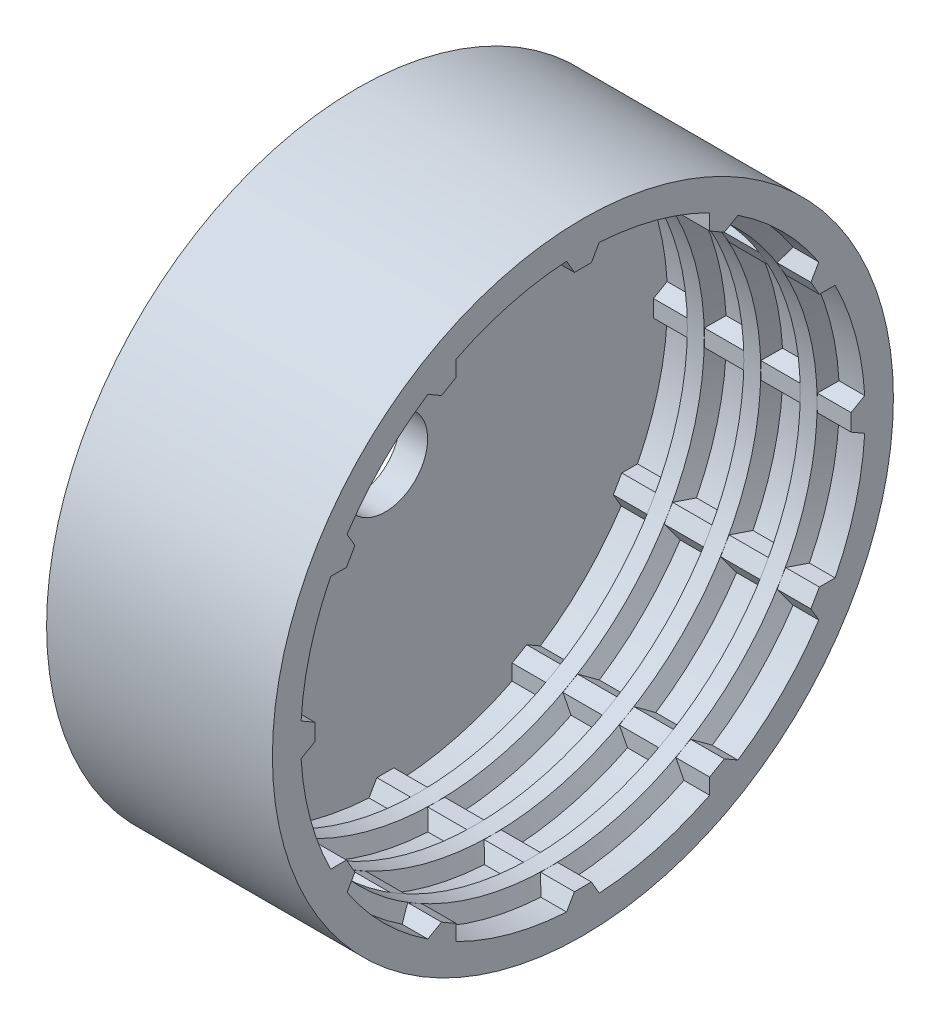
from build123d import *
from build123d.topology import SkipClean

# Parameters (mm, degrees)
SKETCH1_W           = 1.905
SKETCH1_H           = 1.5875
BOSS_EXTRUDE1_REACH = 56.161
CIRPATTERN1_COUNT   = 12


with BuildPart() as part:
    # Sketch1 → Revolve1 (revolve)
    with BuildSketch(Plane(origin=(0, 0, 0), x_dir=(1, 0, 0), z_dir=(0, 1, 0)), mode=Mode.PRIVATE) as revolve1_sk:
        Polygon((6.985, 31.75), (6.068456448, 31.75), (6.985, 30.1625), align=None)
        with Locations((7.9375, 30.95625)):
            Rectangle(SKETCH1_W, SKETCH1_H)
        Polygon((9.806543552, 31.75), (8.89, 31.75), (8.89, 30.1625), align=None)
        with Locations((7.9375, 32.54375)):
            Rectangle(SKETCH1_W, SKETCH1_H)
        with Locations((14.2875, 32.54375)):
            Rectangle(SKETCH1_W, SKETCH1_H)
        Polygon((13.335, 31.75), (12.418456448, 31.75), (13.335, 30.1625), align=None)
        Polygon((15.24, 30.1625), (16.156543552, 31.75), (15.24, 31.75), align=None)
        Polygon((19.685, 30.1625), (19.685, 31.75), (18.768456448, 31.75), align=None)
        with Locations((20.6375, 30.95625)):
            Rectangle(SKETCH1_W, SKETCH1_H)
        Polygon((21.59, 30.1625), (22.506543552, 31.75), (21.59, 31.75), align=None)
        with Locations((20.6375, 32.54375)):
            Rectangle(SKETCH1_W, SKETCH1_H)
        Polygon((0, 34.925), (0, 4.7625), (3.175, 4.7625), (3.175, 31.75), (6.068456448, 31.75), (6.985, 31.75), (6.985, 33.3375), (8.89, 33.3375), (8.89, 31.75), (9.806543552, 31.75), (12.418456448, 31.75), (13.335, 31.75), (13.335, 33.3375), (15.24, 33.3375), (15.24, 31.75), (16.156543552, 31.75), (18.768456448, 31.75), (19.685, 31.75), (19.685, 33.3375), (21.59, 33.3375), (21.59, 31.75), (22.506543552, 31.75), (25.4, 31.75), (25.4, 34.925), align=None)
        with Locations((14.2875, 30.95625)):
            Rectangle(SKETCH1_W, SKETCH1_H)
    revolve(revolve1_sk.sketch.rotate(Axis((1.5875, 0, 0), (1, 0, 0)), 180), axis=Axis((1.5875, 0, 0), (1, 0, 0)))

    # Boss-Extrude1: up to this face of the body (flat: up to its plane)
    boss_extrude1_end = Plane(part.part.faces().sort_by_distance((25.4, 0, -32.737828173))[0])
    # Sketch2 → Boss-Extrude1 (add, up to the picked face)
    with BuildSketch(Plane(origin=(3.175, 0, 0), x_dir=(0, 0, -1), z_dir=(1, 0, 0)), mode=Mode.PRIVATE) as boss_extrude1_sk1:
        with BuildLine():
            Line((-0.9525, 30.1625), (0.9525, 30.1625))
            Line((0.9525, 30.1625), (1.838292546, 31.696737695))
            ThreePointArc((1.838292546, 31.696737695), (0, 31.75), (-1.838292546, 31.696737695))
            Line((-1.838292546, 31.696737695), (-0.9525, 30.1625))
        make_face()
    boss_extrude1_tool1 = split(extrude(boss_extrude1_sk1.sketch, amount=BOSS_EXTRUDE1_REACH, mode=Mode.PRIVATE), bisect_by=boss_extrude1_end, keep=Keep.BOTH, mode=Mode.PRIVATE)
    boss_extrude1 = boss_extrude1_tool1.solids().sort_by(Axis((3.175, 31.031709, 0), (1, 0, 0)))[0]
    add(boss_extrude1)

    # CirPattern1: Boss-Extrude1 ×12 about axis
    cirpattern1_axis = Axis((0, 0, 0), (1, 0, 0))
    for i in range(1, CIRPATTERN1_COUNT):
        add(boss_extrude1.rotate(cirpattern1_axis, i * 360 / CIRPATTERN1_COUNT))


solid = part.part
